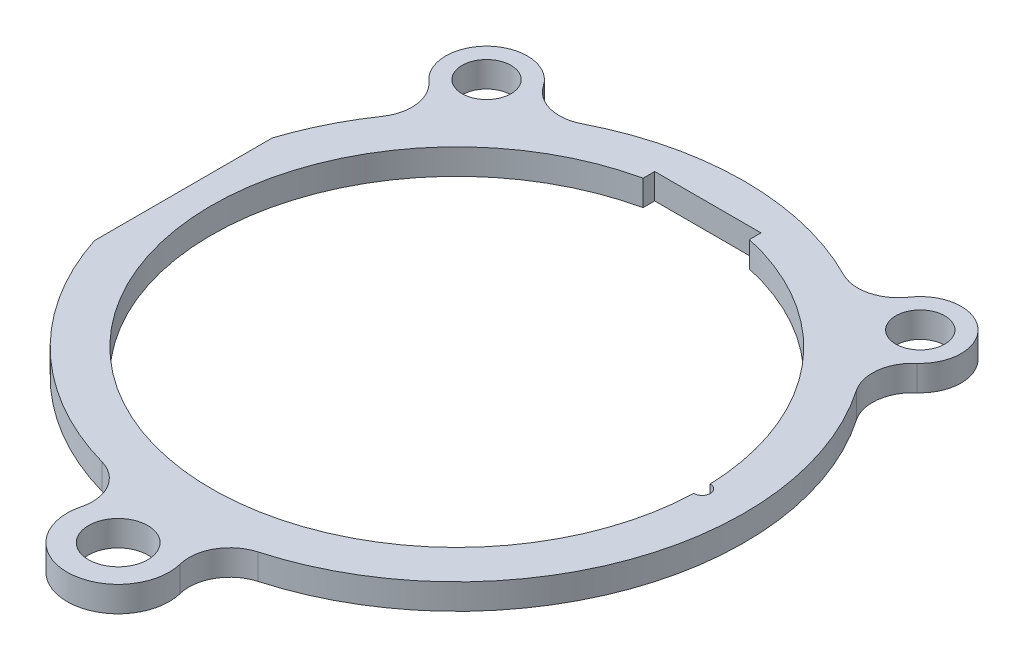
from build123d import *
from build123d.topology import SkipClean

# Parameters (mm, degrees)
SKETCH1_R           = 21.59
BOSS_EXTRUDE1_DEPTH = 0.79375
SKETCH2_R           = 1.4224
CUT_EXTRUDE1_DEPTH  = 31.574112518
CUT_EXTRUDE2_DEPTH  = 31.574112518
SKETCH4_R           = 0.508
CUT_EXTRUDE3_DEPTH  = 31.574112518
SKETCH5_R           = 1.0922
CUT_EXTRUDE4_DEPTH  = 31.574112518
SKETCH6_R           = 1.524
SKETCH6_R_2         = 1.8415
BOSS_EXTRUDE2_DEPTH = 1.5875


with BuildPart() as part:
    # Sketch1 → Boss-Extrude1 (new, symmetric)
    with BuildSketch(Plane(origin=(0, 0, 0), x_dir=(1, 0, 0), z_dir=(0, 1, 0))):
        with Locations(Location((0, 0, 0), (0, 0, 270))):
            Circle(SKETCH1_R)
        with BuildLine():
            Line((-3.302, 14.8779836), (-3.302, 15.5956))
            Line((-3.302, 15.5956), (3.302, 15.5956))
            Line((3.302, 15.5956), (3.302, 14.8779836))
            ThreePointArc((3.302, 14.8779836), (11.8865487, 9.537691545), (15.24, 0))
            ThreePointArc((15.24, 0), (-9.537691545, -11.8865487), (-3.302, 14.8779836))
        make_face(mode=Mode.SUBTRACT)
    extrude(amount=BOSS_EXTRUDE1_DEPTH, both=True)

    # Sketch2 → Cut-Extrude1 (cut, through all)
    with BuildSketch(Plane(origin=(0, 0.79375, 0), x_dir=(1, 0, 0), z_dir=(0, 1, 0))):
        with Locations(Location((0, 18.415, 0), (0, 0, 270))):
            Circle(SKETCH2_R)
        with Locations(Location((0, -18.415, 0), (0, 0, 270))):
            Circle(SKETCH2_R)
    extrude(amount=-CUT_EXTRUDE1_DEPTH, mode=Mode.SUBTRACT)

    # Sketch3 → Cut-Extrude2 (cut, through all)
    with BuildSketch(Plane(origin=(0, 0.79375, 0), x_dir=(1, 0, 0), z_dir=(0, 1, 0))):
        with BuildLine():
            Line((-20.871224203, 5.5245), (-16.984058744, 5.5245))
            Line((-16.984058744, 5.5245), (-16.984058744, -5.5245))
            Line((-16.984058744, -5.5245), (-20.871224203, -5.5245))
            ThreePointArc((-20.871224203, -5.5245), (-21.59, 0), (-20.871224203, 5.5245))
        make_face()
    extrude(amount=-CUT_EXTRUDE2_DEPTH, mode=Mode.SUBTRACT)

    # Sketch4 → Cut-Extrude3 (cut, through all)
    with BuildSketch(Plane(origin=(0, 0.79375, 0), x_dir=(1, 0, 0), z_dir=(0, 1, 0))):
        with Locations((15.24, 0)):
            Circle(SKETCH4_R)
    extrude(amount=-CUT_EXTRUDE3_DEPTH, mode=Mode.SUBTRACT)

    # Sketch5 → Cut-Extrude4 (cut, through all)
    # profile 1 of 16: a face of its own
    with BuildSketch(Plane(origin=(0, 0.79375, 0), x_dir=(1, 0, 0), z_dir=(0, 1, 0))):
        with BuildLine():
            ThreePointArc((-16.984058744, 5.5245), (-16.237733521, 7.437362555), (-15.276788696, 9.25192298))
            Line((-15.276788696, 9.25192298), (-17.314108781, 10.80523309))
            ThreePointArc((-17.314108781, 10.80523309), (-17.76113274, 11.28937197), (-18.016469323, 11.896845513))
            ThreePointArc((-18.016469323, 11.896845513), (-19.70316913, 8.826846902), (-20.871224203, 5.5245))
            Line((-20.871224203, 5.5245), (-16.984058744, 5.5245))
        make_face()
    # profile 2 of 16: a face of its own
    with BuildSketch(Plane(origin=(0, 0.79375, 0), x_dir=(1, 0, 0), z_dir=(0, 1, 0))):
        with BuildLine():
            Line((-17.314108781, 10.80523309), (-15.276788696, 9.25192298))
            ThreePointArc((-15.276788696, 9.25192298), (-14.202798716, 10.828613037), (-12.966760902, 12.28175327))
            Line((-12.966760902, 12.28175327), (-15.004080987, 13.83506338))
            ThreePointArc((-15.004080987, 13.83506338), (-15.589304916, 14.13793931), (-16.242705475, 14.223312513))
            ThreePointArc((-16.242705475, 14.223312513), (-17.169038314, 13.0901575), (-18.016469323, 11.896845513))
            ThreePointArc((-18.016469323, 11.896845513), (-17.76113274, 11.28937197), (-17.314108781, 10.80523309))
        make_face()
        with Locations((-16.159094884, 12.320148235)):
            Circle(SKETCH5_R, mode=Mode.SUBTRACT)
    # profile 3 of 16: a face of its own
    with BuildSketch(Plane(origin=(0, 0.79375, 0), x_dir=(1, 0, 0), z_dir=(0, 1, 0))):
        with Locations((-16.159094884, 12.320148235)):
            Circle(SKETCH5_R)
    # profile 4 of 16: a face of its own
    with BuildSketch(Plane(origin=(0, 0.79375, 0), x_dir=(1, 0, 0), z_dir=(0, 1, 0))):
        with BuildLine():
            Line((-15.004080987, 13.83506338), (-12.966760902, 12.28175327))
            ThreePointArc((-12.966760902, 12.28175327), (-7.645640437, 16.140710455), (-1.288911844, 17.813395463))
            ThreePointArc((-1.288911844, 17.813395463), (-0.308118121, 19.803627014), (1.4224, 18.415))
            ThreePointArc((1.4224, 18.415), (1.388627014, 18.106881879), (1.288911844, 17.813395463))
            ThreePointArc((1.288911844, 17.813395463), (5.420875683, 17.017416329), (9.25192298, 15.276788696))
            Line((9.25192298, 15.276788696), (10.80523309, 17.314108781))
            ThreePointArc((10.80523309, 17.314108781), (11.28937197, 17.76113274), (11.896845513, 18.016469323))
            ThreePointArc((11.896845513, 18.016469323), (-2.884204284, 21.396482553), (-16.242705475, 14.223312513))
            ThreePointArc((-16.242705475, 14.223312513), (-15.589304916, 14.13793931), (-15.004080987, 13.83506338))
        make_face()
    # profile 5 of 16: a face of its own
    with BuildSketch(Plane(origin=(0, 0.79375, 0), x_dir=(1, 0, 0), z_dir=(0, 1, 0))):
        with BuildLine():
            Line((10.80523309, 17.314108781), (9.25192298, 15.276788696))
            ThreePointArc((9.25192298, 15.276788696), (10.828613037, 14.202798716), (12.28175327, 12.966760902))
            Line((12.28175327, 12.966760902), (13.83506338, 15.004080987))
            ThreePointArc((13.83506338, 15.004080987), (14.13793931, 15.589304916), (14.223312513, 16.242705475))
            ThreePointArc((14.223312513, 16.242705475), (13.0901575, 17.169038314), (11.896845513, 18.016469323))
            ThreePointArc((11.896845513, 18.016469323), (11.28937197, 17.76113274), (10.80523309, 17.314108781))
        make_face()
        with Locations((12.320148235, 16.159094884)):
            Circle(SKETCH5_R, mode=Mode.SUBTRACT)
    # profile 6 of 16: a face of its own
    with BuildSketch(Plane(origin=(0, 0.79375, 0), x_dir=(1, 0, 0), z_dir=(0, 1, 0))):
        with Locations((12.320148235, 16.159094884)):
            Circle(SKETCH5_R)
    # profile 7 of 16: a face of its own
    with BuildSketch(Plane(origin=(0, 0.79375, 0), x_dir=(1, 0, 0), z_dir=(0, 1, 0))):
        with BuildLine():
            Line((13.83506338, 15.004080987), (12.28175327, 12.966760902))
            ThreePointArc((12.28175327, 12.966760902), (16.406249356, 7.057856172), (17.859965052, 0))
            ThreePointArc((17.859965052, 0), (17.202053132, -4.802886604), (15.276788696, -9.25192298))
            Line((15.276788696, -9.25192298), (17.314108781, -10.80523309))
            ThreePointArc((17.314108781, -10.80523309), (17.76113274, -11.28937197), (18.016469323, -11.896845513))
            ThreePointArc((18.016469323, -11.896845513), (21.396482553, 2.884204284), (14.223312513, 16.242705475))
            ThreePointArc((14.223312513, 16.242705475), (14.13793931, 15.589304916), (13.83506338, 15.004080987))
        make_face()
    # profile 8 of 16: a face of its own
    with BuildSketch(Plane(origin=(0, 0.79375, 0), x_dir=(1, 0, 0), z_dir=(0, 1, 0))):
        with BuildLine():
            ThreePointArc((4.602470139, -19.883377319), (4.576225926, -20.541808877), (4.327227494, -21.151907768))
            ThreePointArc((4.327227494, -21.151907768), (10.852736689, -18.664035104), (16.242705475, -14.223312513))
            ThreePointArc((16.242705475, -14.223312513), (15.589304916, -14.13793931), (15.004080987, -13.83506338))
            Line((15.004080987, -13.83506338), (12.966760902, -12.28175327))
            ThreePointArc((12.966760902, -12.28175327), (8.977744233, -15.439509712), (4.260223404, -17.344418359))
            Line((4.260223404, -17.344418359), (4.602470139, -19.883377319))
        make_face()
    # profile 9 of 16: a face of its own
    with BuildSketch(Plane(origin=(0, 0.79375, 0), x_dir=(1, 0, 0), z_dir=(0, 1, 0))):
        with BuildLine():
            ThreePointArc((15.004080987, -13.83506338), (15.589304916, -14.13793931), (16.242705475, -14.223312513))
            ThreePointArc((16.242705475, -14.223312513), (17.169038314, -13.0901575), (18.016469323, -11.896845513))
            ThreePointArc((18.016469323, -11.896845513), (17.76113274, -11.28937197), (17.314108781, -10.80523309))
            Line((17.314108781, -10.80523309), (15.276788696, -9.25192298))
            ThreePointArc((15.276788696, -9.25192298), (14.202798716, -10.828613037), (12.966760902, -12.28175327))
            Line((12.966760902, -12.28175327), (15.004080987, -13.83506338))
        make_face()
        with Locations((16.159094884, -12.320148235)):
            Circle(SKETCH5_R, mode=Mode.SUBTRACT)
    # profile 10 of 16: a face of its own
    with BuildSketch(Plane(origin=(0, 0.79375, 0), x_dir=(1, 0, 0), z_dir=(0, 1, 0))):
        with Locations((16.159094884, -12.320148235)):
            Circle(SKETCH5_R)
    # profile 11 of 16: a face of its own
    with BuildSketch(Plane(origin=(0, 0.79375, 0), x_dir=(1, 0, 0), z_dir=(0, 1, 0))):
        with BuildLine():
            ThreePointArc((0.826620277, -20.392354546), (1.026270462, -21.020335978), (1.427926458, -21.542727915))
            ThreePointArc((1.427926458, -21.542727915), (2.884204284, -21.396482553), (4.327227494, -21.151907768))
            ThreePointArc((4.327227494, -21.151907768), (4.576225926, -20.541808877), (4.602470139, -19.883377319))
            Line((4.602470139, -19.883377319), (4.260223404, -17.344418359))
            ThreePointArc((4.260223404, -17.344418359), (2.784458723, -17.64157423), (1.288911844, -17.813395463))
            ThreePointArc((1.288911844, -17.813395463), (1.388627014, -18.106881879), (1.4224, -18.415))
            ThreePointArc((1.4224, -18.415), (1.235821862, -19.119248596), (0.725034865, -19.638742704))
            Line((0.725034865, -19.638742704), (0.826620277, -20.392354546))
        make_face()
        with Locations((2.714545208, -20.137865932)):
            Circle(SKETCH5_R, mode=Mode.SUBTRACT)
    # profile 12 of 16: a face of its own
    with BuildSketch(Plane(origin=(0, 0.79375, 0), x_dir=(1, 0, 0), z_dir=(0, 1, 0))):
        with Locations((2.714545208, -20.137865932)):
            Circle(SKETCH5_R)
    # profile 13 of 16: a face of its own
    with BuildSketch(Plane(origin=(0, 0.79375, 0), x_dir=(1, 0, 0), z_dir=(0, 1, 0))):
        with BuildLine():
            ThreePointArc((-1.288911844, -17.813395463), (-5.420875683, -17.017416329), (-9.25192298, -15.276788696))
            Line((-9.25192298, -15.276788696), (-10.80523309, -17.314108781))
            ThreePointArc((-10.80523309, -17.314108781), (-11.28937197, -17.76113274), (-11.896845513, -18.016469323))
            ThreePointArc((-11.896845513, -18.016469323), (-5.523422079, -20.871509494), (1.427926458, -21.542727915))
            ThreePointArc((1.427926458, -21.542727915), (1.026270462, -21.020335978), (0.826620277, -20.392354546))
            Line((0.826620277, -20.392354546), (0.725034865, -19.638742704))
            ThreePointArc((0.725034865, -19.638742704), (-0.955229003, -19.468925667), (-1.288911844, -17.813395463))
        make_face()
    # profile 14 of 16: a face of its own
    with BuildSketch(Plane(origin=(0, 0.79375, 0), x_dir=(1, 0, 0), z_dir=(0, 1, 0))):
        with BuildLine():
            ThreePointArc((-14.223312513, -16.242705475), (-14.13793931, -15.589304916), (-13.83506338, -15.004080987))
            Line((-13.83506338, -15.004080987), (-12.28175327, -12.966760902))
            ThreePointArc((-12.28175327, -12.966760902), (-15.098634046, -9.539895263), (-16.984058744, -5.5245))
            Line((-16.984058744, -5.5245), (-20.871224203, -5.5245))
            ThreePointArc((-20.871224203, -5.5245), (-18.34738698, -11.379872188), (-14.223312513, -16.242705475))
        make_face()
    # profile 15 of 16: a face of its own
    with BuildSketch(Plane(origin=(0, 0.79375, 0), x_dir=(1, 0, 0), z_dir=(0, 1, 0))):
        with BuildLine():
            Line((-12.28175327, -12.966760902), (-13.83506338, -15.004080987))
            ThreePointArc((-13.83506338, -15.004080987), (-14.13793931, -15.589304916), (-14.223312513, -16.242705475))
            ThreePointArc((-14.223312513, -16.242705475), (-13.0901575, -17.169038314), (-11.896845513, -18.016469323))
            ThreePointArc((-11.896845513, -18.016469323), (-11.28937197, -17.76113274), (-10.80523309, -17.314108781))
            Line((-10.80523309, -17.314108781), (-9.25192298, -15.276788696))
            ThreePointArc((-9.25192298, -15.276788696), (-10.828613037, -14.202798716), (-12.28175327, -12.966760902))
        make_face()
        with Locations((-12.320148235, -16.159094884)):
            Circle(SKETCH5_R, mode=Mode.SUBTRACT)
    # profile 16 of 16: a face of its own
    with BuildSketch(Plane(origin=(0, 0.79375, 0), x_dir=(1, 0, 0), z_dir=(0, 1, 0))):
        with Locations((-12.320148235, -16.159094884)):
            Circle(SKETCH5_R)
    extrude(amount=-CUT_EXTRUDE4_DEPTH, mode=Mode.SUBTRACT)

    # Sketch6 → Boss-Extrude2 (add)
    # profile 1 of 4: a face of its own
    with SkipClean():  # the faces are left unmerged after this step: merging them gives an invalid solid
        with BuildSketch(Plane(origin=(0, 0.79375, 0), x_dir=(1, 0, 0), z_dir=(0, 1, 0))):
            with BuildLine():
                ThreePointArc((-1.288911844, 17.813395463), (0, 16.9926), (1.288911844, 17.813395463))
                ThreePointArc((1.288911844, 17.813395463), (0, 17.859965052), (-1.288911844, 17.813395463))
            make_face()
        # profile 2 of 4: a face of its own
        with BuildSketch(Plane(origin=(0, 0.79375, 0), x_dir=(1, 0, 0), z_dir=(0, 1, 0))):
            with BuildLine():
                ThreePointArc((11.369129677, 16.746637514), (9.899497811, 15.713153014), (8.113736865, 15.910550769))
                ThreePointArc((8.113736865, 15.910550769), (11.793381225, 13.412475944), (14.741706448, 10.082680331))
                ThreePointArc((14.741706448, 10.082680331), (14.317457479, 11.828509879), (15.15442109, 13.41828971))
                ThreePointArc((15.15442109, 13.41828971), (15.147832178, 17.227454162), (11.369129677, 16.746637514))
            make_face()
            with Locations(Location((13.470606702, 15.319965052, 0), (0, 0, 270))):
                Circle(SKETCH6_R, mode=Mode.SUBTRACT)
        # profile 3 of 4: a face of its own
        with BuildSketch(Plane(origin=(0, 0.79375, 0), x_dir=(1, 0, 0), z_dir=(0, 1, 0))):
            with BuildLine():
                ThreePointArc((-8.113737056, 15.910550671), (-9.899497891, 15.713153034), (-11.369129649, 16.746637472))
                ThreePointArc((-11.369129649, 16.746637472), (-15.147832152, 17.227454185), (-15.154421104, 13.418289722))
                ThreePointArc((-15.154421104, 13.418289722), (-14.317457489, 11.828509956), (-14.741706372, 10.082680443))
                ThreePointArc((-14.741706372, 10.082680443), (-11.793381255, 13.412475918), (-8.113737056, 15.910550671))
            make_face()
            with Locations(Location((-13.470606702, 15.319965052, 0), (0, 0, 270))):
                Circle(SKETCH6_R, mode=Mode.SUBTRACT)
        # profile 4 of 4: a face of its own
        with BuildSketch(Plane(origin=(0, 0.79375, 0), x_dir=(1, 0, 0), z_dir=(0, 1, 0))):
            with BuildLine():
                ThreePointArc((3.078011458, -20.256202915), (3.341190791, -18.362372667), (4.850583348, -17.188664662))
                ThreePointArc((4.850583348, -17.188664662), (3.085599204, -17.591402139), (1.288911844, -17.813395463))
                ThreePointArc((1.288911844, -17.813395463), (0, -16.9926), (-1.288911844, -17.813395463))
                ThreePointArc((-1.288911844, -17.813395463), (-3.08559897, -17.59140218), (-4.85058289, -17.188664791))
                ThreePointArc((-4.85058289, -17.188664791), (-3.34119067, -18.362372877), (-3.07801146, -20.256202925))
                ThreePointArc((-3.07801146, -20.256202925), (5e-09, -24.209965052), (3.078011458, -20.256202915))
            make_face()
            with Locations(Location((0, -21.034965052, 0), (0, 0, 270))):
                Circle(SKETCH6_R_2, mode=Mode.SUBTRACT)
        extrude(amount=-BOSS_EXTRUDE2_DEPTH)


solid = part.part
